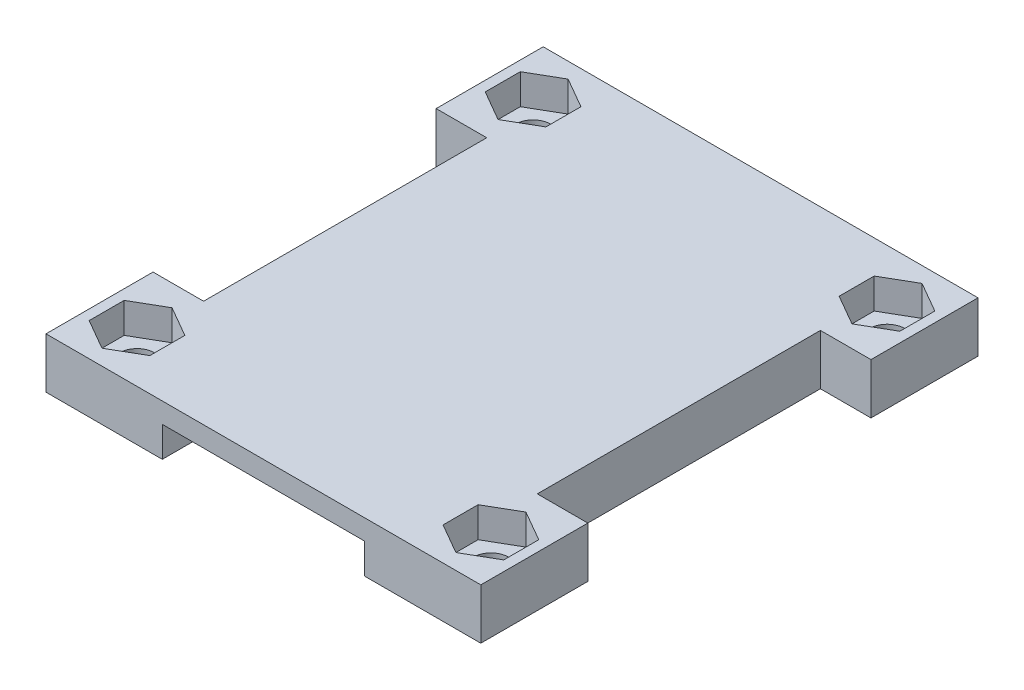
from build123d import *

# Parameters (mm, degrees)
SKETCH1_W           = 43
SKETCH1_H           = 49.17
BOSS_EXTRUDE1_DEPTH = 5
CUT_EXTRUDE1_DEPTH  = 3
SKETCH4_R           = 1.75
CUT_EXTRUDE2_DEPTH  = 66.388752091
SKETCH5_W           = 5
SKETCH5_H           = 28
CUT_EXTRUDE3_DEPTH  = 66.510983049
SKETCH7_W           = 20
SKETCH7_H           = 49.17
CUT_EXTRUDE4_DEPTH  = 3


with BuildPart() as part:
    # Sketch1 → Boss-Extrude1 (new body)
    with BuildSketch(Plane(origin=(0, 0, 0), x_dir=(1, 0, 0), z_dir=(0, 1, 0))):
        with Locations((-21.5, 24.585)):
            Rectangle(SKETCH1_W, SKETCH1_H)
    extrude(amount=BOSS_EXTRUDE1_DEPTH)

    # Sketch2 → Cut-Extrude1 (cut)
    with BuildSketch(Plane(origin=(0, 5, 0), x_dir=(1, 0, 0), z_dir=(0, 1, 0))):
        Polygon((-1, 42.437949192), (-4, 40.705898385), (-7, 42.437949192), (-7, 45.902050808), (-4, 47.634101615), (-1, 45.902050808), align=None)
        Polygon((-4, 8.464101615), (-7, 6.732050808), (-7, 3.267949192), (-4, 1.535898385), (-1, 3.267949192), (-1, 6.732050808), align=None)
        Polygon((-42, 6.732050808), (-39, 8.464101615), (-36, 6.732050808), (-36, 3.267949192), (-39, 1.535898385), (-42, 3.267949192), align=None)
        Polygon((-42, 45.902050808), (-42, 42.437949192), (-39, 40.705898385), (-36, 42.437949192), (-36, 45.902050808), (-39, 47.634101615), align=None)
    extrude(amount=-CUT_EXTRUDE1_DEPTH, mode=Mode.SUBTRACT)

    # Sketch4 → Cut-Extrude2 (cut, through all)
    with BuildSketch(Plane(origin=(0, 2, 0), x_dir=(1, 0, 0), z_dir=(0, 1, 0))):
        with Locations(Location((-39, 44.17, 0), (0, 0, 270))):
            Circle(SKETCH4_R)
        with Locations(Location((-39, 5, 0), (0, 0, 90))):
            Circle(SKETCH4_R)
        with Locations(Location((-4, 5, 0), (0, 0, 270))):
            Circle(SKETCH4_R)
        with Locations(Location((-4, 44.17, 0), (0, 0, 90))):
            Circle(SKETCH4_R)
    extrude(amount=-CUT_EXTRUDE2_DEPTH, mode=Mode.SUBTRACT)

    # Sketch5 → Cut-Extrude3 (cut, through all)
    with BuildSketch(Plane(origin=(0, 5, 0), x_dir=(1, 0, 0), z_dir=(0, 1, 0))):
        with Locations((-2.5, 24.585)):
            Rectangle(SKETCH5_W, SKETCH5_H)
        with Locations((-40.5, 24.585)):
            Rectangle(SKETCH5_W, SKETCH5_H)
    extrude(amount=-CUT_EXTRUDE3_DEPTH, mode=Mode.SUBTRACT)

    # Sketch7 → Cut-Extrude4 (cut)
    with BuildSketch(Plane.XZ):
        with Locations((-21.5, -24.585)):
            Rectangle(SKETCH7_W, SKETCH7_H)
    extrude(amount=-CUT_EXTRUDE4_DEPTH, mode=Mode.SUBTRACT)


solid = part.part
